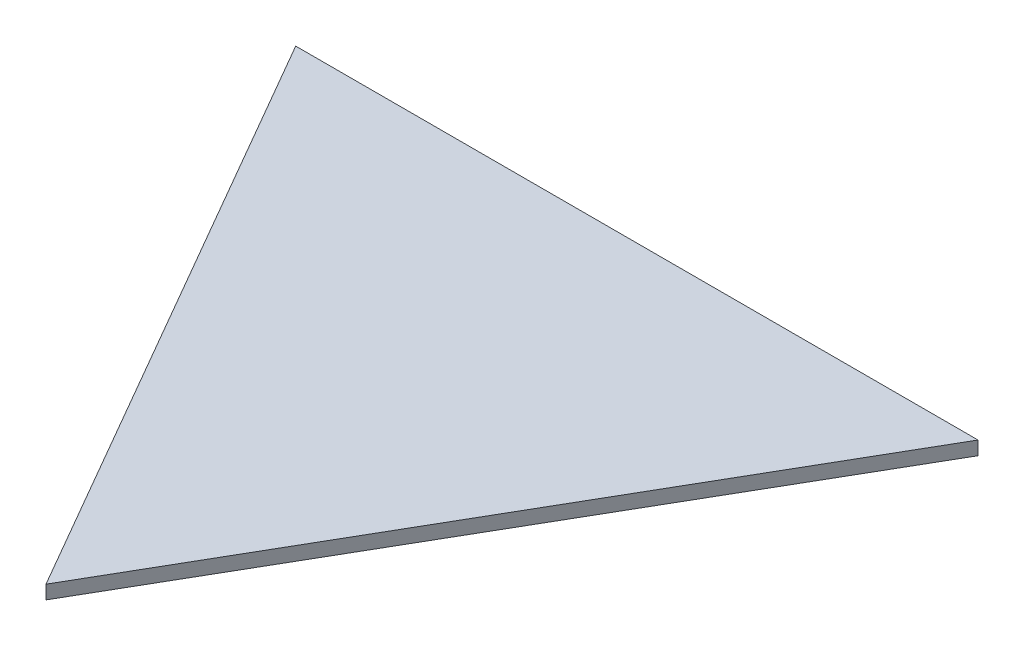
from build123d import *

# Parameters (mm, degrees)
EXTRUDE1_DEPTH = 10


with BuildPart() as part:
    # Sketch1 → Extrude1 (new body)
    with BuildSketch(Plane(origin=(0, 0, 0), x_dir=(1, 0, 0), z_dir=(0, 1, 0))):
        Polygon((-250, 144.33), (0, -288.67), (250, 144.33), align=None)
    extrude(amount=EXTRUDE1_DEPTH)


solid = part.part
